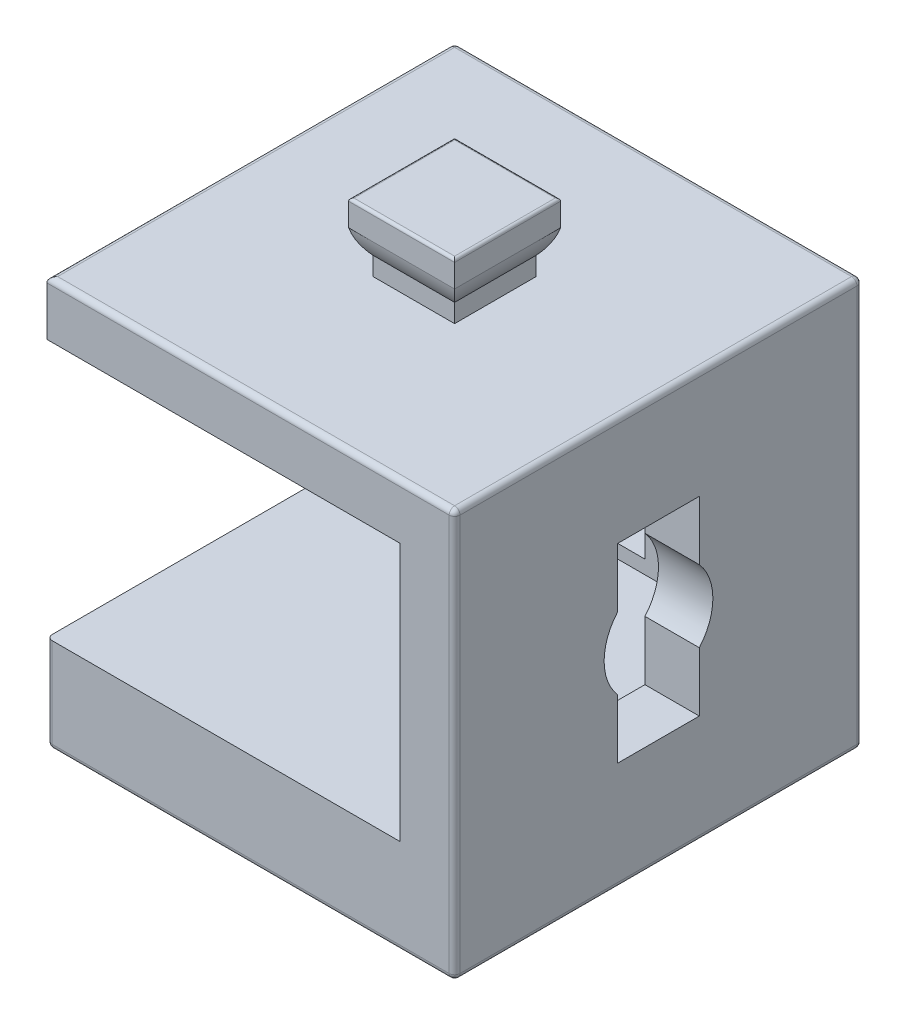
from build123d import *

# Parameters (mm, degrees)
SKETCH_1_W                      = 15
SKETCH_1_H                      = 15
EXTRUDE_1_DEPTH                 = 15
SKETCH_2_W                      = 13
SKETCH_2_H                      = 9.5
CUT_EXTRUDE_1_DEPTH             = 13
EXTRUDE_START                   = -4.5
EXTRUDE_2_DEPTH                 = 6
SKETCH_5_W                      = 3
SKETCH_5_H                      = 3
EXTRUDE_3_DEPTH                 = 1
CUT_EXTRUDE_3_REACH             = 26.238
CUT_EXTRUDE_4_REACH             = 29.5
CUT_EXTRUDE_5_REACH             = 26.238
CUT_EXTRUDE_5_DIRECTION_2_REACH = 26.238
FILLET_1_R                      = 0.1
FILLET_2_R                      = 0.2
EXTRUDE_4_DEPTH                 = 3
EXTRUDE_4_DEPTH_BACK            = 3
CUT_EXTRUDE_6_DEPTH             = 15
FILLET_3_R                      = 0.1


with BuildPart() as part:
    # 草图1 → 凸台-拉伸1 (new body)
    with BuildSketch(Plane.XY):
        with Locations((0, 7.5)):
            Rectangle(SKETCH_1_W, SKETCH_1_H)
    extrude(amount=-EXTRUDE_1_DEPTH)

    # 草图2 → 切除-拉伸1 (cut)
    with BuildSketch(Plane.ZY.offset(7.5)):
        with Locations((-6.5, 8.25)):
            Rectangle(SKETCH_2_W, SKETCH_2_H)
    extrude(amount=-CUT_EXTRUDE_1_DEPTH, mode=Mode.SUBTRACT)



with BuildPart() as body_2:
    # 草图4 → 凸台-拉伸2 (new body)
    with BuildSketch(Plane.XY.offset(EXTRUDE_START)):
        with BuildLine():
            Line((-1.5, 15.677124344), (1.5, 15.677124344))
            ThreePointArc((1.5, 15.677124344), (1.780042303, 16.088161527), (1.95, 16.555590279))
            Line((1.95, 16.555590279), (1.95, 17.5))
            Line((1.95, 17.5), (-1.95, 17.5))
            Line((-1.95, 17.5), (-1.95, 16.555590279))
            ThreePointArc((-1.95, 16.555590279), (-1.780042303, 16.088161527), (-1.5, 15.677124344))
        make_face()
    extrude(amount=-EXTRUDE_2_DEPTH)


with BuildPart() as part_1:
    add(part.part)

    add(body_2.part)  # 凸台-拉伸3 merges body 2
    # 草图5 → 凸台-拉伸3 (add)
    with BuildSketch(Plane(origin=(0, 15, 0), x_dir=(-1, 0, 0), z_dir=(0, 1, 0))):
        with Locations((0, -7.5)):
            Rectangle(SKETCH_5_W, SKETCH_5_H)
    extrude(amount=EXTRUDE_3_DEPTH)

    # 草图6 → 切除-拉伸3 (cut, up to next)
    with BuildSketch(Plane(origin=(0, 0, -15), x_dir=(-1, 0, 0), z_dir=(0, 0, -1)), mode=Mode.PRIVATE) as cut_extrude_3_sk1:
        with BuildLine():
            Line((-1.5, 6.177124344), (-1.5, 4))
            Line((-1.5, 4), (1.5, 4))
            Line((1.5, 4), (1.5, 6.177124344))
            ThreePointArc((1.5, 6.177124344), (2, 7.5), (1.5, 8.822875656))
            Line((1.5, 8.822875656), (1.5, 11))
            Line((1.5, 11), (-1.5, 11))
            Line((-1.5, 11), (-1.5, 8.822875656))
            ThreePointArc((-1.5, 8.822875656), (-2, 7.5), (-1.5, 6.177124344))
        make_face()
    cut_extrude_3_tool1 = extrude(cut_extrude_3_sk1.sketch, amount=-CUT_EXTRUDE_3_REACH, mode=Mode.PRIVATE) & part_1.part
    add(cut_extrude_3_tool1.solids().sort_by_distance((0, 7.5, -15))[0], mode=Mode.SUBTRACT)

    # 草图7 → 切除-拉伸4 (cut, up to next)
    with BuildSketch(Plane(origin=(7.5, 0, 0), x_dir=(0, 0, -1), z_dir=(1, 0, 0)), mode=Mode.PRIVATE) as cut_extrude_4_sk1:
        with BuildLine():
            Line((6, 6.177124344), (6, 4))
            Line((6, 4), (9, 4))
            Line((9, 4), (9, 6.177124344))
            ThreePointArc((9, 6.177124344), (9.5, 7.5), (9, 8.822875656))
            Line((9, 8.822875656), (9, 11))
            Line((9, 11), (6, 11))
            Line((6, 11), (6, 8.822875656))
            ThreePointArc((6, 8.822875656), (5.5, 7.5), (6, 6.177124344))
        make_face()
    cut_extrude_4_tool1 = extrude(cut_extrude_4_sk1.sketch, amount=-CUT_EXTRUDE_4_REACH, mode=Mode.PRIVATE) & part_1.part
    add(cut_extrude_4_tool1.solids().sort_by_distance((7.5, 7.5, -7.5))[0], mode=Mode.SUBTRACT)

    # 草图8 → 切除-拉伸5 (cut, up to next)
    with BuildSketch(Plane(origin=(0, 0, 0), x_dir=(0, 0, -1), z_dir=(1, 0, 0)), mode=Mode.PRIVATE) as cut_extrude_5_sk1:
        with BuildLine():
            Line((5.55, 17.5), (5.55, 16.555590279))
            ThreePointArc((5.55, 16.555590279), (5.719957697, 16.088161527), (6, 15.677124344))
            Line((6, 15.677124344), (4.5, 15.677124344))
            Line((4.5, 15.677124344), (4.5, 17.5))
            Line((4.5, 17.5), (5.55, 17.5))
        make_face()
    cut_extrude_5_tool1 = extrude(cut_extrude_5_sk1.sketch, amount=-CUT_EXTRUDE_5_REACH, mode=Mode.PRIVATE) & part_1.part
    # 草图8 → 切除-拉伸5 (cut, up to next)
    with BuildSketch(Plane(origin=(0, 0, 0), x_dir=(0, 0, -1), z_dir=(1, 0, 0)), mode=Mode.PRIVATE) as cut_extrude_5_sk2:
        with BuildLine():
            Line((10.5, 17.5), (9.45, 17.5))
            Line((9.45, 17.5), (9.45, 16.555590279))
            ThreePointArc((9.45, 16.555590279), (9.280042303, 16.088161527), (9, 15.677124344))
            Line((9, 15.677124344), (10.5, 15.677124344))
            Line((10.5, 15.677124344), (10.5, 17.5))
        make_face()
    cut_extrude_5_tool2 = extrude(cut_extrude_5_sk2.sketch, amount=-CUT_EXTRUDE_5_REACH, mode=Mode.PRIVATE) & part_1.part
    add(cut_extrude_5_tool1.solids().sort_by_distance((0, 16.539049, -5.075076))[0], mode=Mode.SUBTRACT)
    add(cut_extrude_5_tool2.solids().sort_by_distance((0, 16.539049, -9.924924))[0], mode=Mode.SUBTRACT)

    # 草图8 → 切除-拉伸5 direction 2 (cut, up to next)
    with BuildSketch(Plane(origin=(0, 0, 0), x_dir=(0, 0, -1), z_dir=(1, 0, 0)), mode=Mode.PRIVATE) as cut_extrude_5_direction_2_sk1:
        with BuildLine():
            Line((5.55, 17.5), (5.55, 16.555590279))
            ThreePointArc((5.55, 16.555590279), (5.719957697, 16.088161527), (6, 15.677124344))
            Line((6, 15.677124344), (4.5, 15.677124344))
            Line((4.5, 15.677124344), (4.5, 17.5))
            Line((4.5, 17.5), (5.55, 17.5))
        make_face()
    cut_extrude_5_direction_2_tool1 = extrude(cut_extrude_5_direction_2_sk1.sketch, amount=CUT_EXTRUDE_5_DIRECTION_2_REACH, mode=Mode.PRIVATE) & part_1.part
    # 草图8 → 切除-拉伸5 direction 2 (cut, up to next)
    with BuildSketch(Plane(origin=(0, 0, 0), x_dir=(0, 0, -1), z_dir=(1, 0, 0)), mode=Mode.PRIVATE) as cut_extrude_5_direction_2_sk2:
        with BuildLine():
            Line((10.5, 17.5), (9.45, 17.5))
            Line((9.45, 17.5), (9.45, 16.555590279))
            ThreePointArc((9.45, 16.555590279), (9.280042303, 16.088161527), (9, 15.677124344))
            Line((9, 15.677124344), (10.5, 15.677124344))
            Line((10.5, 15.677124344), (10.5, 17.5))
        make_face()
    cut_extrude_5_direction_2_tool2 = extrude(cut_extrude_5_direction_2_sk2.sketch, amount=CUT_EXTRUDE_5_DIRECTION_2_REACH, mode=Mode.PRIVATE) & part_1.part
    add(cut_extrude_5_direction_2_tool1.solids().sort_by_distance((0, 16.539049, -5.075076))[0], mode=Mode.SUBTRACT)
    add(cut_extrude_5_direction_2_tool2.solids().sort_by_distance((0, 16.539049, -9.924924))[0], mode=Mode.SUBTRACT)

    # 圆角1
    fillet_1_edges = [part_1.edges().sort_by_distance(p)[0] for p in [
        (0, 17.5, -5.55),
        (1.95, 17.5, -7.5),
        (-1.95, 17.5, -7.5),
        (0, 17.5, -9.45),
    ]]
    fillet(fillet_1_edges, radius=FILLET_1_R)

    # 圆角2
    fillet_2_edges = [part_1.edges().sort_by_distance(p)[0] for p in [
        (0, 0, 0),
        (7.5, 0, -7.5),
        (0, 0, -15),
        (-7.5, 0, -7.5),
        (7.5, 7.5, -15),
        (0, 15, -15),
        (-7.5, 15, -7.5),
        (-7.5, 7.5, -15),
        (-7.5, 1.75, 0),
        (7.5, 7.5, 0),
        (7.5, 15, -7.5),
        (0, 15, 0),
    ]]
    fillet(fillet_2_edges, radius=FILLET_2_R)

    # 草图9 → 凸台-拉伸4 (add, two sides: drawn at the far end of the back side and taken through both)
    with BuildSketch(Plane(origin=(0, 0, 0), x_dir=(0, 0, -1), z_dir=(1, 0, 0)).offset(-EXTRUDE_4_DEPTH_BACK)):
        with BuildLine():
            Line((6, 0), (9, 0))
            Line((9, 0), (9, -0.677124344))
            ThreePointArc((9, -0.677124344), (9.280042303, -1.088161527), (9.45, -1.555590279))
            Line((9.45, -1.555590279), (9.45, -2.5))
            Line((9.45, -2.5), (5.55, -2.5))
            Line((5.55, -2.5), (5.55, -1.555590279))
            ThreePointArc((5.55, -1.555590279), (5.719957697, -1.088161527), (6, -0.677124344))
            Line((6, -0.677124344), (6, 0))
        make_face()
    extrude(amount=EXTRUDE_4_DEPTH + EXTRUDE_4_DEPTH_BACK)

    # 草图10 → 切除-拉伸6 (cut)
    with BuildSketch(Plane.XY):
        with BuildLine():
            Line((-1.95, -2.5), (-1.95, -1.555590279))
            ThreePointArc((-1.95, -1.555590279), (-1.780042303, -1.088161527), (-1.5, -0.677124344))
            Line((-1.5, -0.677124344), (-1.5, 0))
            Line((-1.5, 0), (-3, 0))
            Line((-3, 0), (-3, -2.5))
            Line((-3, -2.5), (-1.95, -2.5))
        make_face()
        with BuildLine():
            Line((1.5, 0), (1.5, -0.677124344))
            ThreePointArc((1.5, -0.677124344), (1.780042303, -1.088161527), (1.95, -1.555590279))
            Line((1.95, -1.555590279), (1.95, -2.5))
            Line((1.95, -2.5), (3, -2.5))
            Line((3, -2.5), (3, 0))
            Line((3, 0), (1.5, 0))
        make_face()
    extrude(amount=-CUT_EXTRUDE_6_DEPTH, mode=Mode.SUBTRACT)

    # 圆角3
    fillet_3_edges = [part_1.edges().sort_by_distance(p)[0] for p in [
        (0, -2.5, -9.45),
        (0, -2.5, -5.55),
        (-1.95, -2.5, -7.5),
        (1.95, -2.5, -7.5),
    ]]
    fillet(fillet_3_edges, radius=FILLET_3_R)


solid = part_1.part
